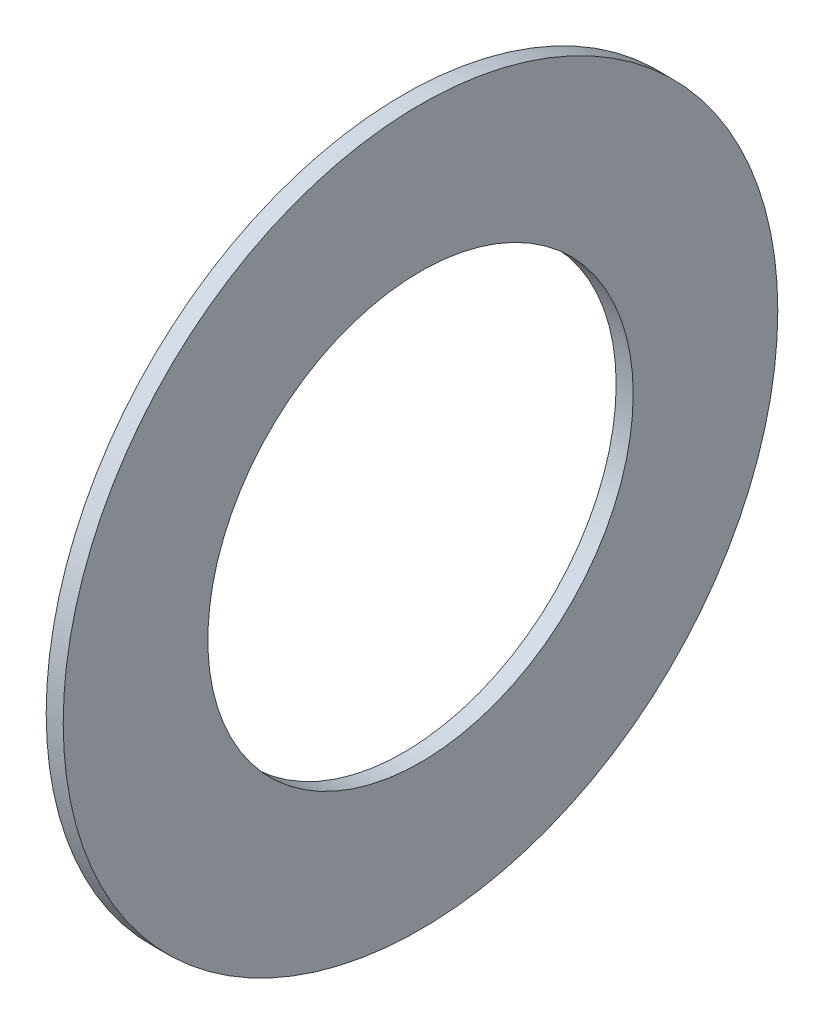
from build123d import *

# Parameters (mm, degrees)
SKETCH1_R      = 21
SKETCH1_R_2    = 12.5
EXTRUDE1_DEPTH = 1


with BuildPart() as part:
    # Sketch1 → Extrude1 (new body)
    with BuildSketch(Plane(origin=(0, 0, 0), x_dir=(0, 0, -1), z_dir=(1, 0, 0))):
        Circle(SKETCH1_R)
        Circle(SKETCH1_R_2, mode=Mode.SUBTRACT)
    extrude(amount=EXTRUDE1_DEPTH)


solid = part.part
